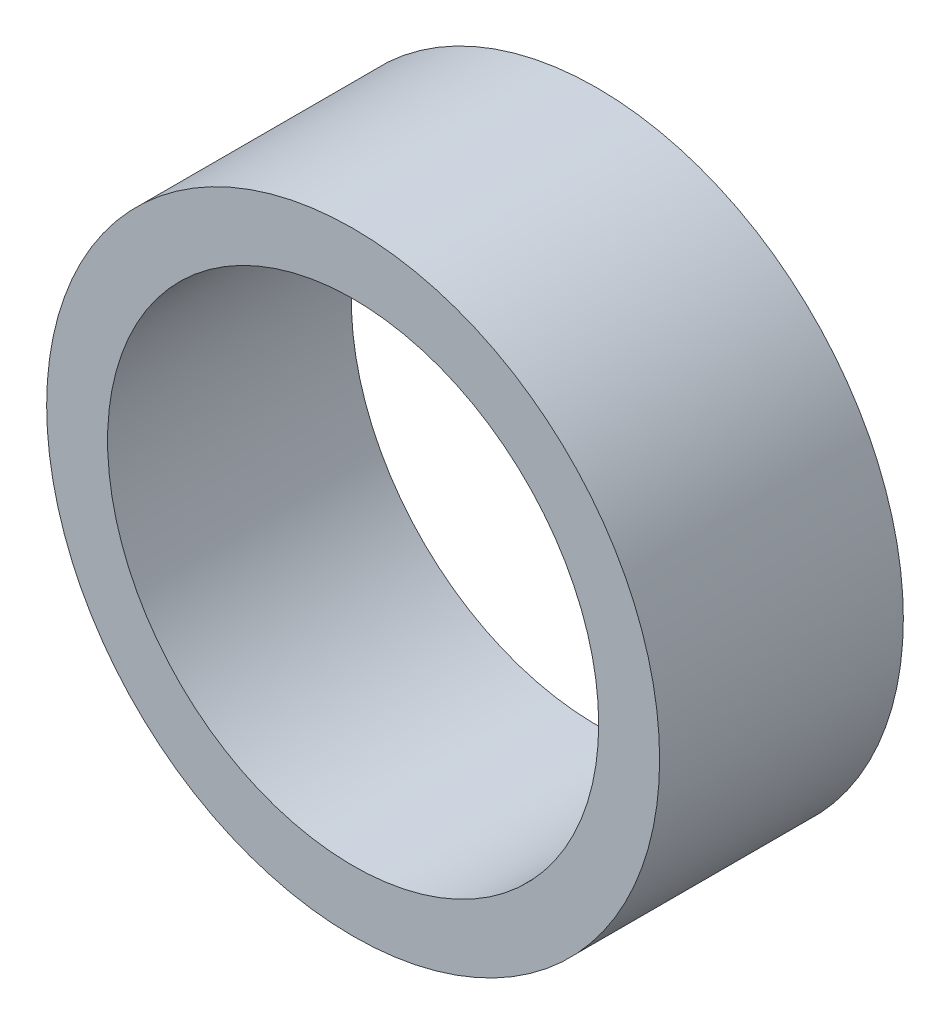
from build123d import *

# Parameters (mm, degrees)
SKETCH1_R           = 5.03
SKETCH1_R_2         = 4.03
EXTRUDE_THIN1_DEPTH = 4


with BuildPart() as part:
    # Sketch1 → Extrude-Thin1 (new body)
    with BuildSketch(Plane.XY):
        Circle(SKETCH1_R)
        Circle(SKETCH1_R_2, mode=Mode.SUBTRACT)
    extrude(amount=EXTRUDE_THIN1_DEPTH)


solid = part.part
